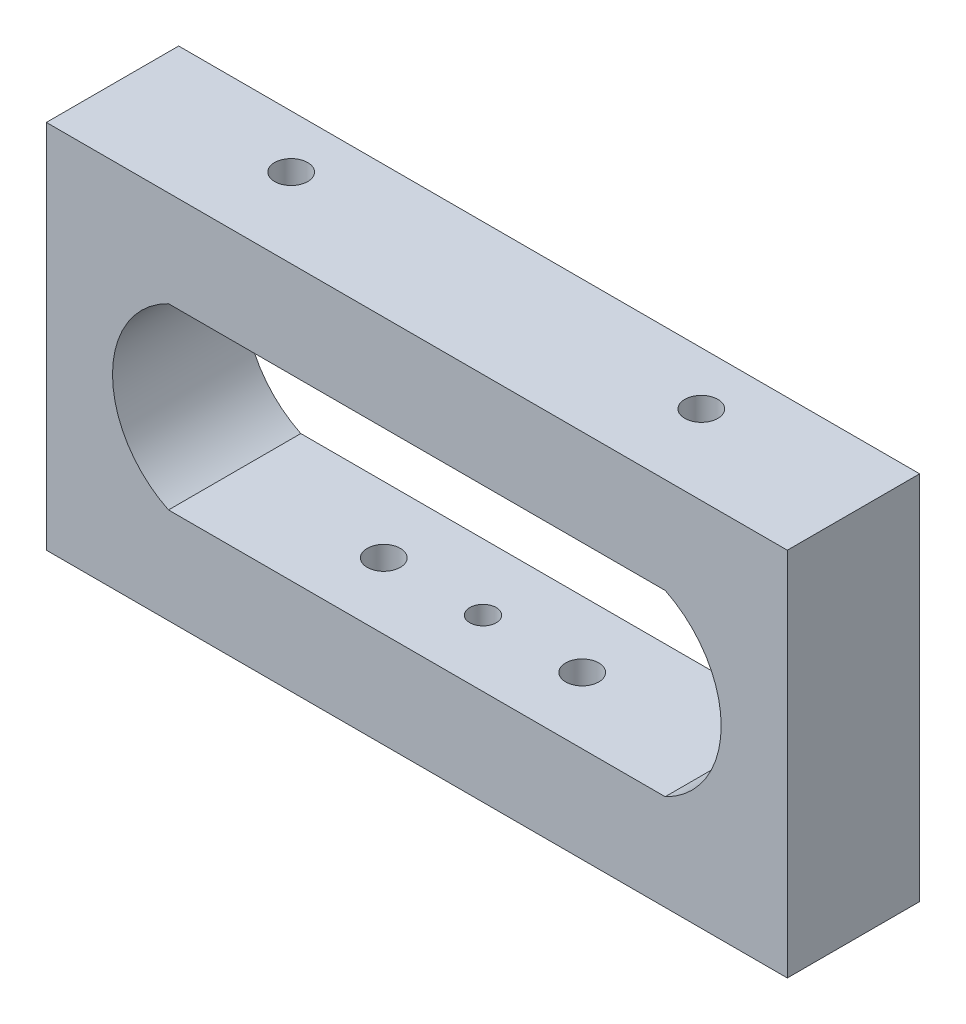
from build123d import *

# Parameters (mm, degrees)
SKIZZE1_W                       = 56
SKIZZE1_H                       = 28
AUFSATZ_LINEAR_AUSTRAGEN1_DEPTH = 10
SCHNITT_LINEAR_AUSTRAGEN1_DEPTH = 33.86335345
KERNLOCH_F_R_M3_GEWINDE1_D      = 2.5
KERNLOCH_F_R_M3_GEWINDE1_DEPTH  = 8.5
KERNLOCH_F_R_M3_GEWINDE1_TIP    = 0.751075774
KERNLOCH_F_R_M3_GEWINDE2_D      = 2.5
KERNLOCH_F_R_M3_GEWINDE2_DEPTH  = 7.25
F_2_0MM_STIFTLOCH1_D            = 2
F_2_0MM_STIFTLOCH1_DEPTH        = 8.5
F_2_0MM_STIFTLOCH1_TIP          = 0.600860619


with BuildPart() as part:
    # Skizze1 → Aufsatz-Linear austragen1 (new body)
    with BuildSketch(Plane.XY):
        Rectangle(SKIZZE1_W, SKIZZE1_H)
    extrude(amount=AUFSATZ_LINEAR_AUSTRAGEN1_DEPTH)

    # Skizze2 → Schnitt-Linear austragen1 (cut, through all)
    with BuildSketch(Plane(origin=(0, 0, 0), x_dir=(-1, 0, 0), z_dir=(0, 0, -1))):
        with BuildLine():
            Line((-18.769174208, 6.75), (18.769174208, 6.75))
            ThreePointArc((18.769174208, 6.75), (23, 0), (18.769174208, -6.75))
            Line((18.769174208, -6.75), (-18.769174208, -6.75))
            ThreePointArc((-18.769174208, -6.75), (-23, 0), (-18.769174208, 6.75))
        make_face()
    extrude(amount=-SCHNITT_LINEAR_AUSTRAGEN1_DEPTH, mode=Mode.SUBTRACT)

    # Kernloch für M3 Gewinde1
    with Locations(Plane(origin=(0, -14, 0), x_dir=(-1, 0, 0), z_dir=(0, -1, 0))):
        with Locations((-7.5, -5), (7.5, -5)):
            Hole(KERNLOCH_F_R_M3_GEWINDE1_D / 2, depth=KERNLOCH_F_R_M3_GEWINDE1_DEPTH)
            with Locations((0, 0, -(KERNLOCH_F_R_M3_GEWINDE1_DEPTH + KERNLOCH_F_R_M3_GEWINDE1_TIP / 2))):  # 118° drill point
                Cone(0, KERNLOCH_F_R_M3_GEWINDE1_D / 2, KERNLOCH_F_R_M3_GEWINDE1_TIP, mode=Mode.SUBTRACT)

    # Kernloch für M3 Gewinde2
    with Locations(Plane(origin=(0, 14, 0), x_dir=(1, 0, 0), z_dir=(0, 1, 0))):
        with Locations((15.5, -4), (-15.5, -4)):
            Hole(KERNLOCH_F_R_M3_GEWINDE2_D / 2, depth=KERNLOCH_F_R_M3_GEWINDE2_DEPTH)

    # Ø2.0mm Stiftloch1
    with Locations(Plane(origin=(0, -14, 0), x_dir=(-1, 0, 0), z_dir=(0, -1, 0))):
        with Locations((0, -5)):
            Hole(F_2_0MM_STIFTLOCH1_D / 2, depth=F_2_0MM_STIFTLOCH1_DEPTH)
            with Locations((0, 0, -(F_2_0MM_STIFTLOCH1_DEPTH + F_2_0MM_STIFTLOCH1_TIP / 2))):  # 118° drill point
                Cone(0, F_2_0MM_STIFTLOCH1_D / 2, F_2_0MM_STIFTLOCH1_TIP, mode=Mode.SUBTRACT)


solid = part.part
